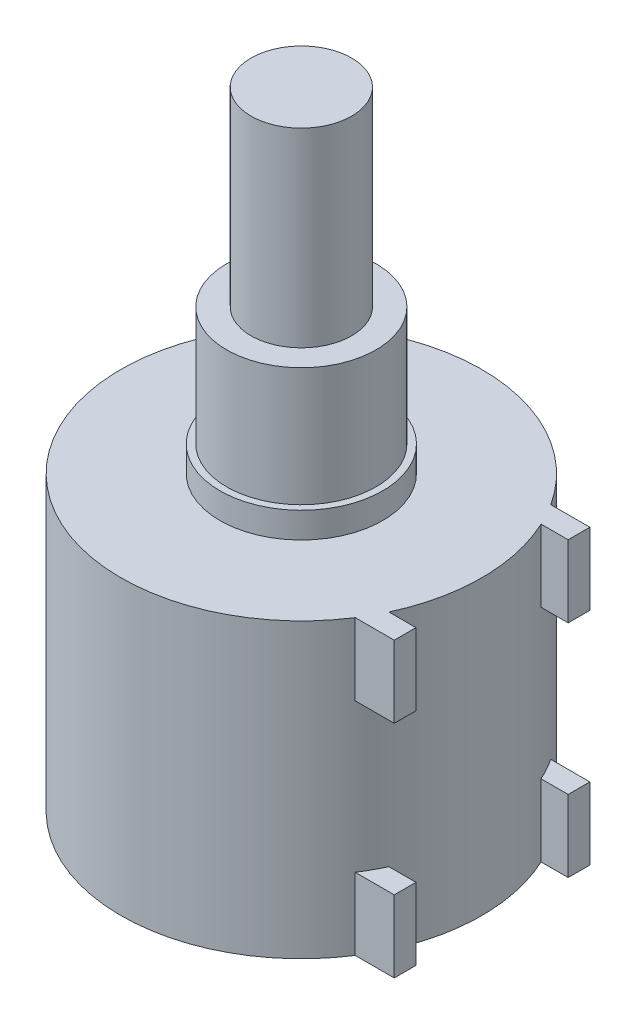
from build123d import *

# Parameters (mm, degrees)
BOSS_EXTRUDE1_REACH      = 48.609
BOSS_EXTRUDE1_END_RADIUS = 11.2014
SKETCH2_W                = 1.3462
SKETCH2_H                = 4.4704


with BuildPart() as part:
    # Sketch1 → Revolve1 (revolve)
    with BuildSketch(Plane.XY):
        Polygon((-11.2014, 18.161), (-11.2014, 0), (0, 0), (0, 38.9382), (-3.1242, 38.9382), (-3.1242, 27.1272), (-4.6355, 27.1272), (-4.6355, 19.7612), (-5.0546, 19.7612), (-5.0546, 18.161), align=None)
    revolve(axis=Axis((0, 0, 0), (0, -1, 0)))

    # Boss-Extrude1: up to this cylinder (the profile starts outside it)
    boss_extrude1_end = Plane(origin=(0, 9.0805, 0), z_dir=(0, 1, 0)) * Cylinder(BOSS_EXTRUDE1_END_RADIUS, 134.3114, mode=Mode.PRIVATE)
    # Sketch2 → Boss-Extrude1 (add, up to the surface)
    with BuildSketch(Plane(origin=(11.8364, 0, 0), x_dir=(0, 0, -1), z_dir=(1, 0, 0)), mode=Mode.PRIVATE) as boss_extrude1_sk1:
        with Locations((-5.3975, 15.9258)):
            Rectangle(SKETCH2_W, SKETCH2_H)
    boss_extrude1_tool1 = extrude(boss_extrude1_sk1.sketch, amount=-BOSS_EXTRUDE1_REACH, mode=Mode.PRIVATE) - boss_extrude1_end
    # Sketch2 → Boss-Extrude1 (add, up to the surface)
    with BuildSketch(Plane(origin=(11.8364, 0, 0), x_dir=(0, 0, -1), z_dir=(1, 0, 0)), mode=Mode.PRIVATE) as boss_extrude1_sk2:
        with Locations((-5.3975, 2.2352)):
            Rectangle(SKETCH2_W, SKETCH2_H)
    boss_extrude1_tool2 = extrude(boss_extrude1_sk2.sketch, amount=-BOSS_EXTRUDE1_REACH, mode=Mode.PRIVATE) - boss_extrude1_end
    boss_extrude1 = boss_extrude1_tool1.solids().sort_by_distance((11.8364, 15.9258, 5.3975))[0] + boss_extrude1_tool2.solids().sort_by_distance((11.8364, 2.2352, 5.3975))[0]
    add(boss_extrude1)

    # Mirror1: Boss-Extrude1 across plane
    add(boss_extrude1.mirror(Plane.XY))


solid = part.part
